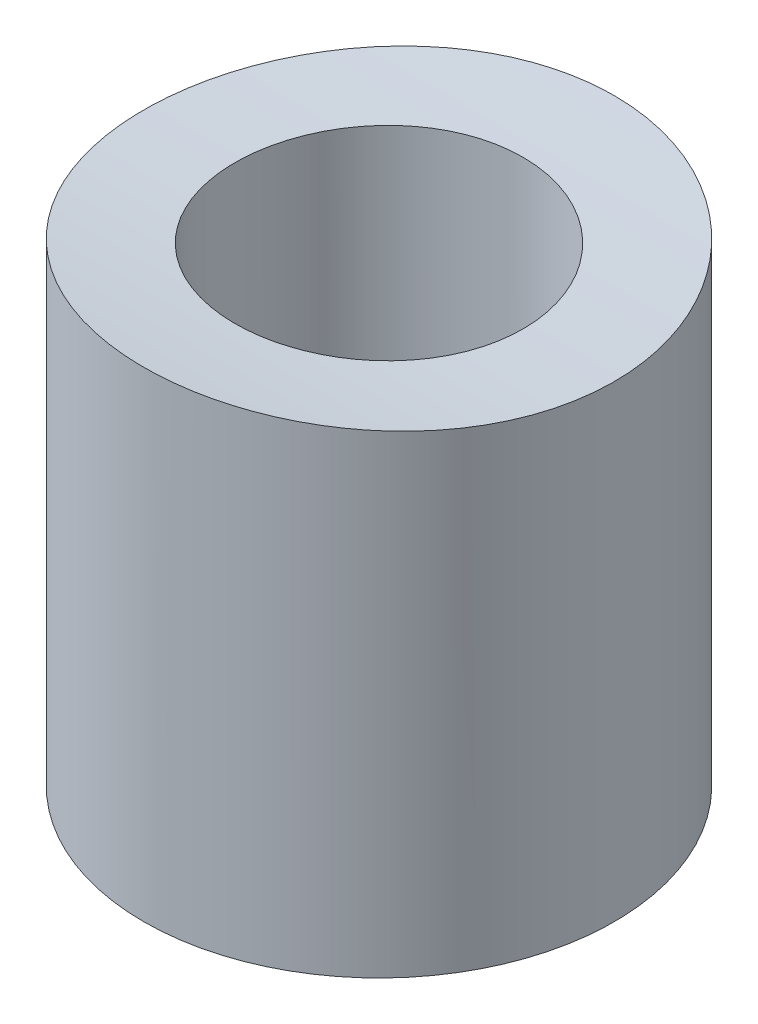
from build123d import *

# Parameters (mm, degrees)
SKETCH1_R               = 24.5
SKETCH1_R_2             = 15
BOSS_EXTRUDE1_DEPTH     = 50
CUT_EXTRUDE1_DEPTH      = 61.831735139
CUT_EXTRUDE1_DEPTH_BACK = 61.831735139


with BuildPart() as part:
    # Sketch1 → Boss-Extrude1 (new body)
    with BuildSketch(Plane(origin=(0, 0, 0), x_dir=(1, 0, 0), z_dir=(0, 1, 0))):
        with Locations(Location((0, 0, 0), (0, 0, 270))):
            Circle(SKETCH1_R)
        with Locations(Location((0, 0, 0), (0, 0, 270))):
            Circle(SKETCH1_R_2, mode=Mode.SUBTRACT)
    extrude(amount=BOSS_EXTRUDE1_DEPTH)

    # Sketch2 → Cut-Extrude1 (cut, two sides: drawn at the far end of the back side and taken through both)
    with BuildSketch(Plane(origin=(0, 0, 0), x_dir=(0, 0, -1), z_dir=(1, 0, 0)).offset(-CUT_EXTRUDE1_DEPTH_BACK)):
        with BuildLine():
            Line((24.5, 50), (-24.5, 50))
            ThreePointArc((-24.5, 50), (0, 48.708886801), (24.5, 50))
        make_face()
    extrude(amount=CUT_EXTRUDE1_DEPTH + CUT_EXTRUDE1_DEPTH_BACK, mode=Mode.SUBTRACT)


solid = part.part
